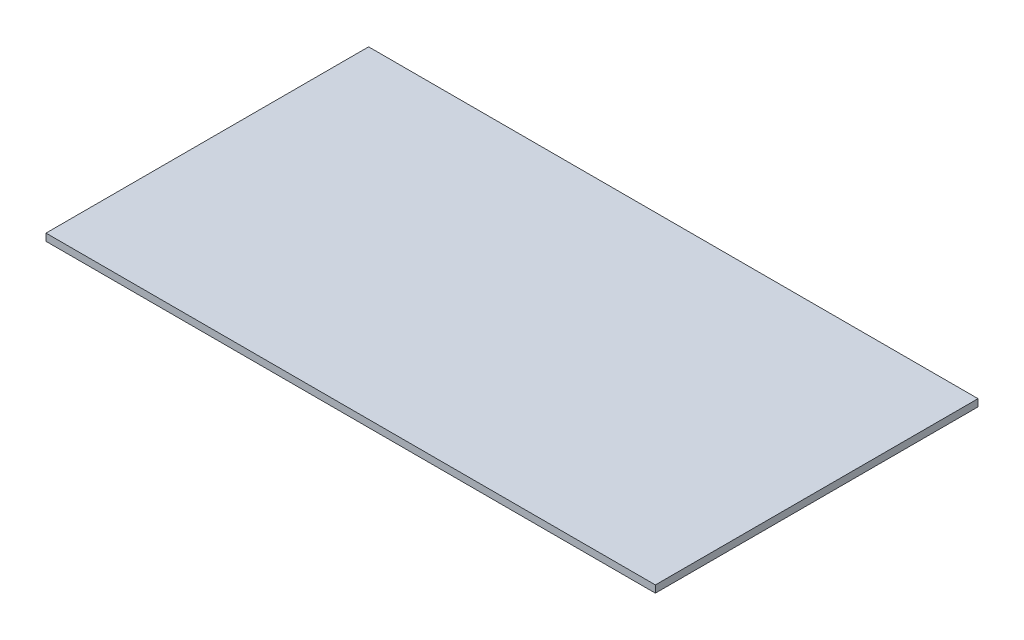
from build123d import *

# Parameters (mm, degrees)
SCHIZZO1_W                   = 850
SCHIZZO1_H                   = 450
ESTRUSIONE_ESTRUSIONE1_DEPTH = 10


with BuildPart() as part:
    # Schizzo1 → Estrusione-Estrusione1 (new body)
    with BuildSketch(Plane(origin=(0, 0, 0), x_dir=(1, 0, 0), z_dir=(0, 1, 0))):
        Rectangle(SCHIZZO1_W, SCHIZZO1_H)
    extrude(amount=ESTRUSIONE_ESTRUSIONE1_DEPTH)


solid = part.part
